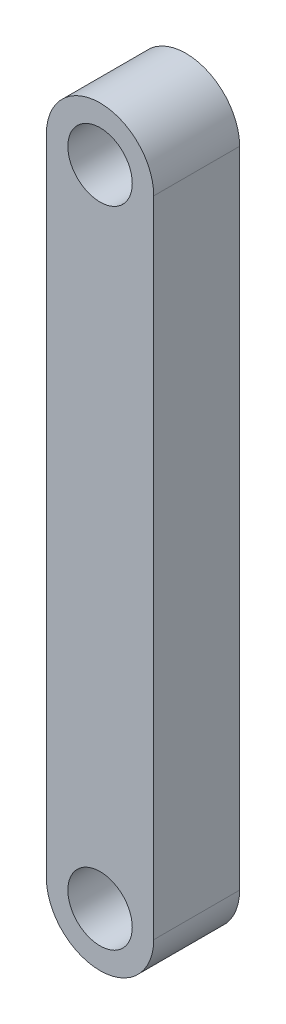
from build123d import *

# Parameters (mm, degrees)
SKIZZE1_R                       = 2.5
SKIZZE1_R_2                     = 1.5
AUFSATZ_LINEAR_AUSTRAGEN1_DEPTH = 4


with BuildPart() as part:
    # Skizze1 → Aufsatz-Linear austragen1 (new body)
    # profile 1 of 3: a face of its own
    with BuildSketch(Plane.XY):
        with Locations((0, 30)):
            Circle(SKIZZE1_R)
        with Locations((0, 30)):
            Circle(SKIZZE1_R_2, mode=Mode.SUBTRACT)
    # profile 2 of 3: a face of its own
    with BuildSketch(Plane.XY):
        with BuildLine():
            ThreePointArc((2.5, 30), (0, 27.5), (-2.5, 30))
            Line((-2.5, 30), (-2.5, 0))
            ThreePointArc((-2.5, 0), (0, 2.5), (2.5, 0))
            Line((2.5, 0), (2.5, 30))
        make_face()
    # profile 3 of 3: a face of its own
    with BuildSketch(Plane.XY):
        Circle(SKIZZE1_R)
        Circle(SKIZZE1_R_2, mode=Mode.SUBTRACT)
    extrude(amount=AUFSATZ_LINEAR_AUSTRAGEN1_DEPTH)


solid = part.part
